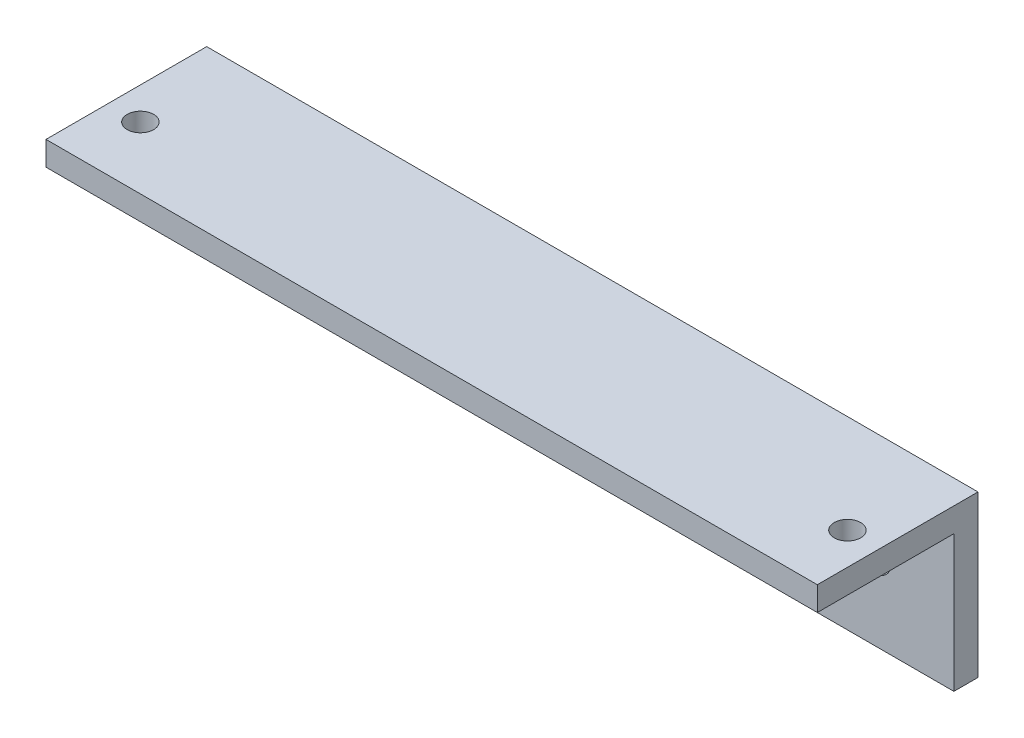
from build123d import *

# Parameters (mm, degrees)
SKETCH_1_W           = 96
SKETCH_1_H           = 20
EXTRUDE_1_DEPTH      = 3
SKETCH_2_W           = 96
SKETCH_2_H           = 3
EXTRUDE_2_DEPTH      = 17
HOLE_WIZARD_M4_1_D   = 4.5
HOLE_WIZARD_M4_1_2_D = 3.3


with BuildPart() as part:
    # 스케치1 → 보스-돌출1 (new body)
    with BuildSketch(Plane.XY):
        Rectangle(SKETCH_1_W, SKETCH_1_H)
    extrude(amount=EXTRUDE_1_DEPTH)

    # 스케치2 → 보스-돌출2 (add)
    with BuildSketch(Plane.XY.offset(3)):
        with Locations((0, 8.5)):
            Rectangle(SKETCH_2_W, SKETCH_2_H)
    extrude(amount=EXTRUDE_2_DEPTH)

    # Hole Wizard M4 _ _1 (through all)
    with Locations(Plane.XY.offset(3)):
        with Locations((-38, 0), (38, 0)):
            Hole(HOLE_WIZARD_M4_1_D / 2)

    # Hole Wizard M4 _ _1 2 (through all)
    with Locations(Plane(origin=(0, 10, 0), x_dir=(1, 0, 0), z_dir=(0, 1, 0))):
        with Locations((-44, -12.25), (44, -12.25)):
            Hole(HOLE_WIZARD_M4_1_2_D / 2)


solid = part.part
